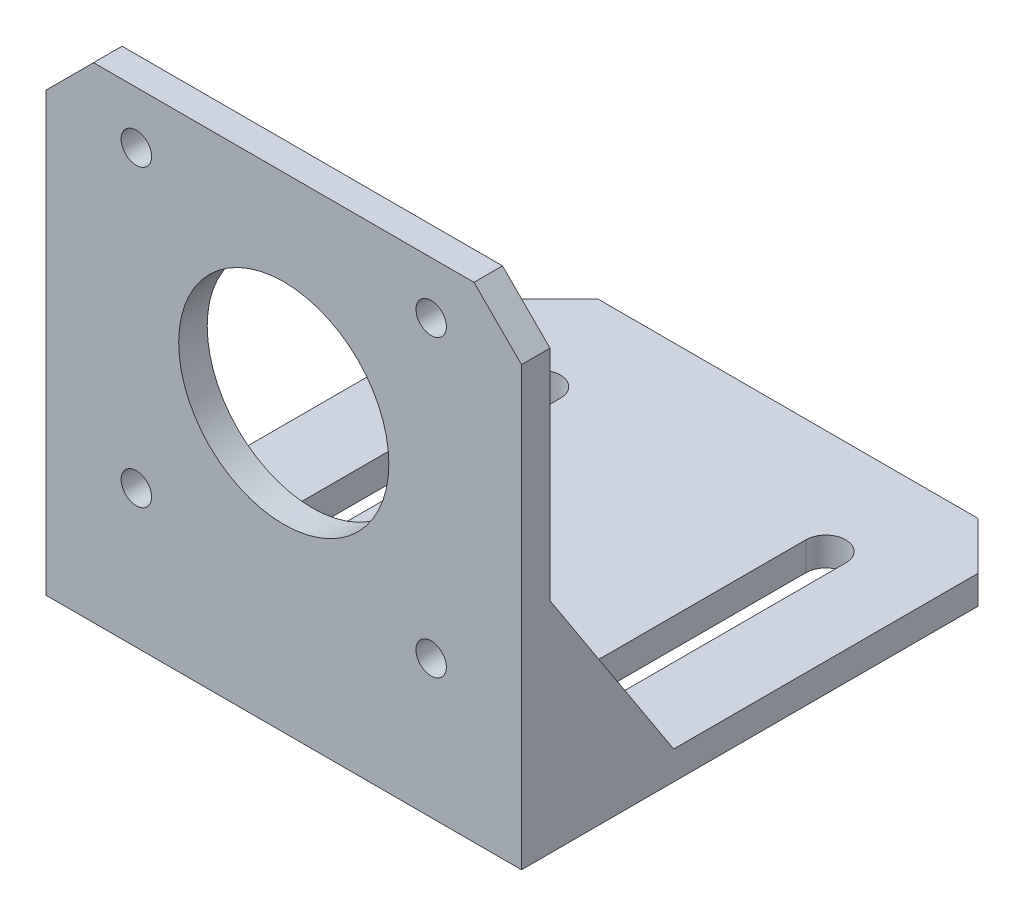
from build123d import *

# Parameters (mm, degrees)
EXTRUDE_1_DEPTH     = 50
SKETCH_4_W          = 44
SKETCH_4_H          = 13
CUT_EXTRUDE_2_DEPTH = 20
CUT_EXTRUDE_3_DEPTH = 88.252507127
SKETCH_6_R          = 11.05
SKETCH_6_R_2        = 1.6
CUT_EXTRUDE_4_DEPTH = 88.183714076


with BuildPart() as part:
    # 草图1 → 凸台-拉伸1 (new body)
    with BuildSketch(Plane(origin=(0, 0, 0), x_dir=(0, 0, -1), z_dir=(1, 0, 0))):
        Polygon((3, 0), (0, 0), (0, -51), (53, -51), (53, -48), (16, -48), (3, -28), align=None)
    extrude(amount=EXTRUDE_1_DEPTH)

    # 草图4 → 切除-拉伸2 (cut)
    with BuildSketch(Plane(origin=(0, -48, 0), x_dir=(1, 0, 0), z_dir=(0, 1, 0))):
        with Locations((25, 9.5)):
            Rectangle(SKETCH_4_W, SKETCH_4_H)
    extrude(amount=CUT_EXTRUDE_2_DEPTH, mode=Mode.SUBTRACT)

    # 草图5 → 切除-拉伸3 (cut, through all)
    with BuildSketch(Plane(origin=(0, -48, 0), x_dir=(1, 0, 0), z_dir=(0, 1, 0))):
        with BuildLine():
            Line((12.1, 42), (12.1, 12))
            ThreePointArc((12.1, 12), (10, 9.9), (7.9, 12))
            Line((7.9, 12), (7.9, 42))
            ThreePointArc((7.9, 42), (10, 44.1), (12.1, 42))
        make_face()
        with BuildLine():
            Line((37.9, 42), (37.9, 12))
            ThreePointArc((37.9, 12), (40, 9.9), (42.1, 12))
            Line((42.1, 12), (42.1, 42))
            ThreePointArc((42.1, 42), (40, 44.1), (37.9, 42))
        make_face()
        Polygon((50, 53), (45, 53), (50, 48), align=None)
        Polygon((5, 53), (0, 48), (0, 53), align=None)
    extrude(amount=-CUT_EXTRUDE_3_DEPTH, mode=Mode.SUBTRACT)

    # 草图6 → 切除-拉伸4 (cut, through all)
    with BuildSketch(Plane(origin=(0, 0, -3), x_dir=(-1, 0, 0), z_dir=(0, 0, -1))):
        with Locations(Location((-25, -21, 0), (0, 0, 90))):
            Circle(SKETCH_6_R)
        with Locations(Location((-40.5, -5.5, 0), (0, 0, 90))):
            Circle(SKETCH_6_R_2)
        with Locations(Location((-9.5, -5.5, 0), (0, 0, 90))):
            Circle(SKETCH_6_R_2)
        with Locations(Location((-9.5, -36.5, 0), (0, 0, 90))):
            Circle(SKETCH_6_R_2)
        with Locations(Location((-40.5, -36.5, 0), (0, 0, 90))):
            Circle(SKETCH_6_R_2)
        Polygon((-50, 0), (-50, -5), (-45, 0), align=None)
        Polygon((0, -5), (-5, 0), (0, 0), align=None)
    extrude(amount=-CUT_EXTRUDE_4_DEPTH, mode=Mode.SUBTRACT)


solid = part.part
